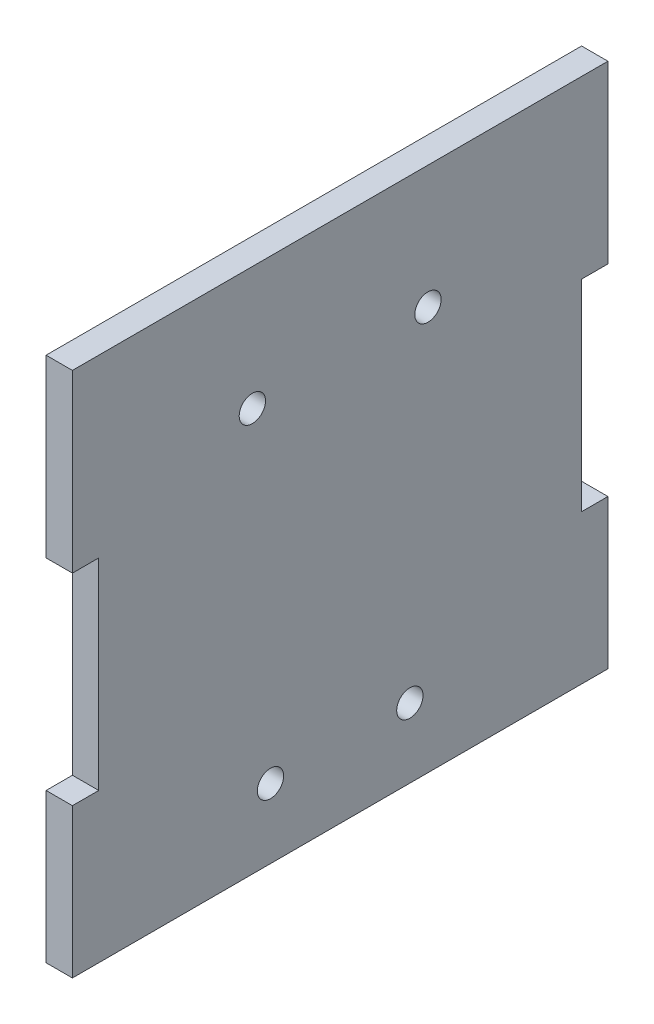
from build123d import *

# Parameters (mm, degrees)
BOSS_EXTRUDE1_DEPTH   = 3
CROQUIS1_R            = 1.5
CORTAR_EXTRUIR1_DEPTH = 10


with BuildPart() as part:
    # Sketch1 → Boss-Extrude1 (new body)
    with BuildSketch(Plane(origin=(0, 0, 0), x_dir=(0, 0, -1), z_dir=(1, 0, 0))):
        Polygon((-27.5, 0), (27.5, 0), (30.5, 0), (30.5, 17), (27.5, 17), (27.5, 39.94), (30.5, 39.94), (30.5, 59.94), (27.5, 59.94), (-27.5, 59.94), (-30.5, 59.94), (-30.5, 39.94), (-27.5, 39.94), (-27.5, 17), (-30.5, 17), (-30.5, 0), align=None)
    extrude(amount=BOSS_EXTRUDE1_DEPTH)

    # Croquis1 → Cortar-Extruir1 (cut)
    with BuildSketch(Plane.ZY):
        with Locations((-7.94, 7.91)):
            Circle(CROQUIS1_R)
        with Locations(Location((7.94, 7.91, 0), (0, 0, 180))):
            Circle(CROQUIS1_R)
        with Locations((-10, 45.94)):
            Circle(CROQUIS1_R)
        with Locations(Location((10, 45.94, 0), (0, 0, 180))):
            Circle(CROQUIS1_R)
    extrude(amount=-CORTAR_EXTRUIR1_DEPTH, mode=Mode.SUBTRACT)


solid = part.part
